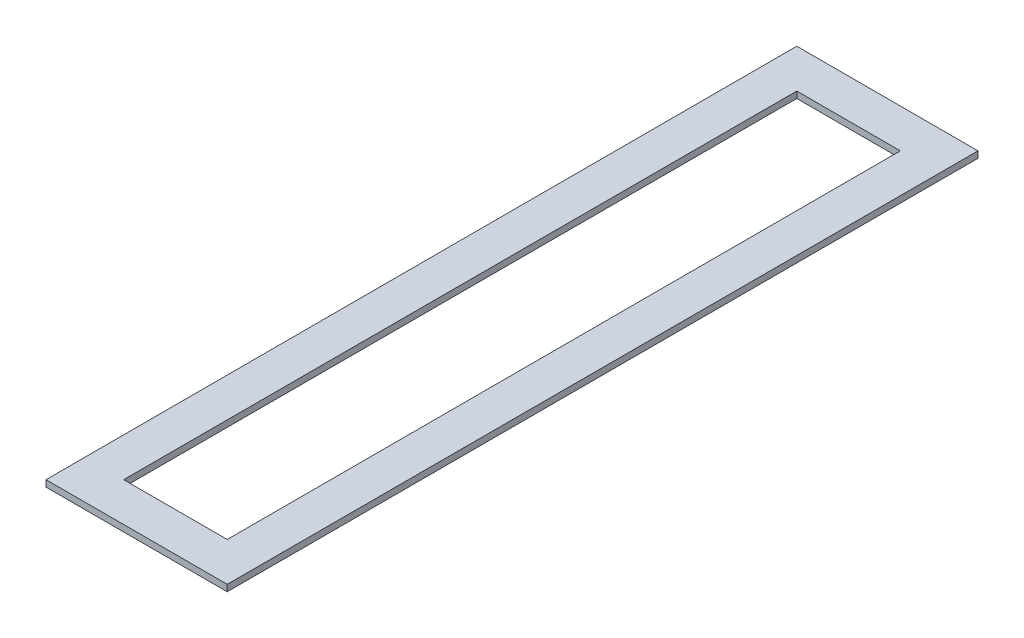
from build123d import *

# Parameters (mm, degrees)
SKETCH6_W           = 28
SKETCH6_H           = 116
SKETCH6_W_2         = 16
SKETCH6_H_2         = 104
BOSS_EXTRUDE1_DEPTH = 1


with BuildPart() as part:
    # Sketch6 → Boss-Extrude1 (new body)
    with BuildSketch(Plane(origin=(0, 0, 0), x_dir=(1, 0, 0), z_dir=(0, 1, 0))):
        Rectangle(SKETCH6_W, SKETCH6_H)
        Rectangle(SKETCH6_W_2, SKETCH6_H_2, mode=Mode.SUBTRACT)
    extrude(amount=BOSS_EXTRUDE1_DEPTH)


solid = part.part
